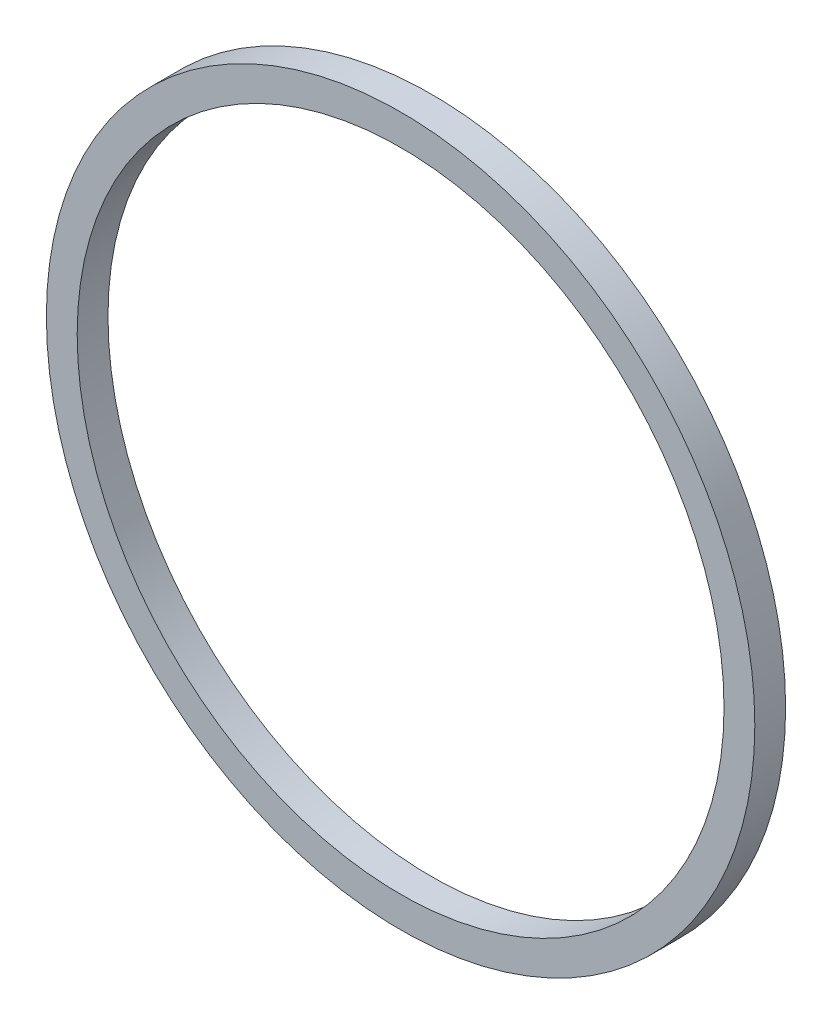
from build123d import *

# Parameters (mm, degrees)
SKIZZE1_R                       = 23
SKIZZE1_R_2                     = 21
AUFSATZ_LINEAR_AUSTRAGEN1_DEPTH = 2


with BuildPart() as part:
    # Skizze1 → Aufsatz-Linear austragen1 (new body)
    with BuildSketch(Plane.XY):
        Circle(SKIZZE1_R)
        Circle(SKIZZE1_R_2, mode=Mode.SUBTRACT)
    extrude(amount=AUFSATZ_LINEAR_AUSTRAGEN1_DEPTH)


solid = part.part
